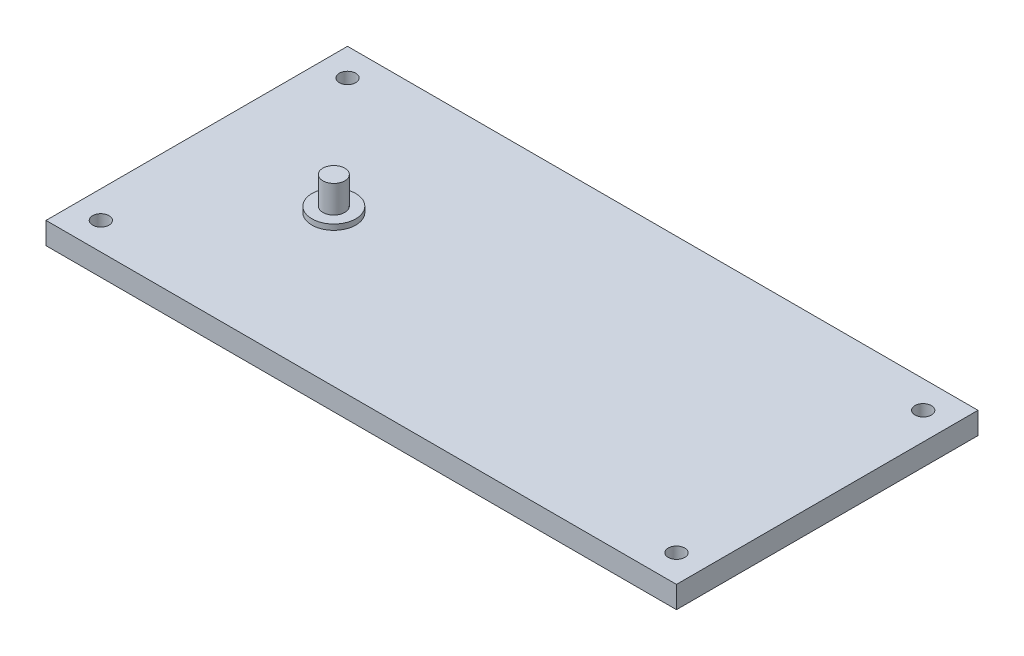
from build123d import *

# Parameters (mm, degrees)
SKETCH_1_W          = 230
SKETCH_1_H          = 110
EXTRUDE_1_DEPTH     = 8
SKETCH_2_R          = 8
EXTRUDE_2_DEPTH     = 2
SKETCH_3_R          = 4
EXTRUDE_3_DEPTH     = 10
SKETCH_4_R          = 3
CUT_EXTRUDE_1_DEPTH = 129.039056541


with BuildPart() as part:
    # 草图1 → 凸台-拉伸1 (new body)
    with BuildSketch(Plane(origin=(0, 0, 0), x_dir=(1, 0, 0), z_dir=(0, 1, 0))):
        Rectangle(SKETCH_1_W, SKETCH_1_H)
    extrude(amount=EXTRUDE_1_DEPTH)

    # 草图2 → 凸台-拉伸2 (add)
    with BuildSketch(Plane(origin=(0, 8, 0), x_dir=(1, 0, 0), z_dir=(0, 1, 0))):
        with Locations(Location((-65, 0, 0), (0, 0, 270))):
            Circle(SKETCH_2_R)
    extrude(amount=EXTRUDE_2_DEPTH)

    # 草图3 → 凸台-拉伸3 (add)
    with BuildSketch(Plane(origin=(0, 10, 0), x_dir=(1, 0, 0), z_dir=(0, 1, 0))):
        with Locations(Location((-65, 0, 0), (0, 0, 270))):
            Circle(SKETCH_3_R)
    extrude(amount=EXTRUDE_3_DEPTH)

    # 草图4 → 切除-拉伸1 (cut, through all)
    with BuildSketch(Plane(origin=(0, 8, 0), x_dir=(1, 0, 0), z_dir=(0, 1, 0))):
        with Locations(Location((-105, 45, 0), (0, 0, 270))):
            Circle(SKETCH_4_R)
        with Locations(Location((-105, -45, 0), (0, 0, 270))):
            Circle(SKETCH_4_R)
        with Locations(Location((105, 45, 0), (0, 0, 270))):
            Circle(SKETCH_4_R)
        with Locations(Location((105, -45, 0), (0, 0, 270))):
            Circle(SKETCH_4_R)
    extrude(amount=-CUT_EXTRUDE_1_DEPTH, mode=Mode.SUBTRACT)


solid = part.part
